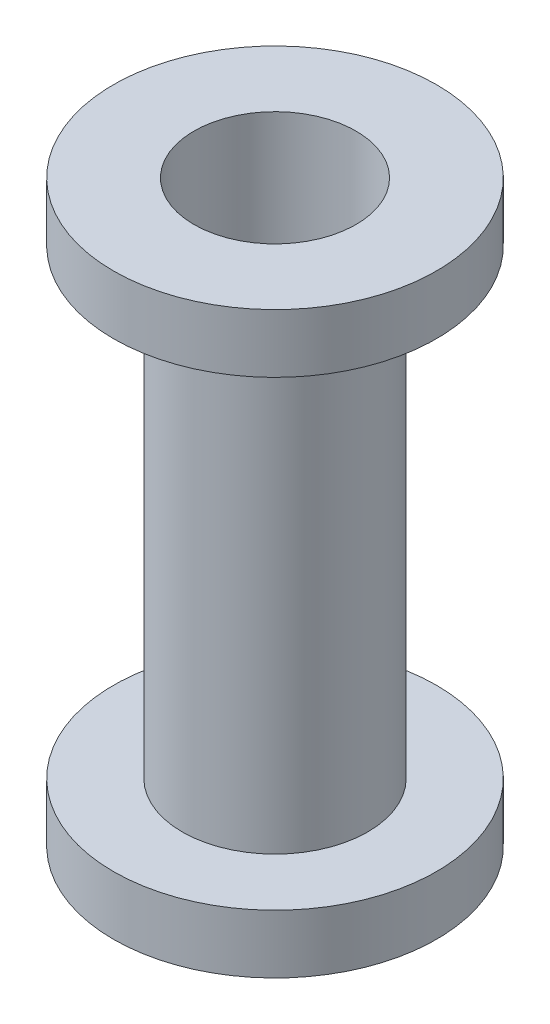
from build123d import *

# Parameters (mm, degrees)
SKETCH1_R      = 20.066
SKETCH1_R_2    = 17.526
EXTRUDE1_DEPTH = 125.222
EXTRUDE2_START = -12.7
SKETCH2_R      = 34.925
SKETCH2_R_2    = 17.526
EXTRUDE2_DEPTH = 12.7
SKETCH3_R      = 34.925
SKETCH3_R_2    = 17.526
EXTRUDE3_DEPTH = 12.7


with BuildPart() as part:
    # Sketch1 → Extrude1 (new body)
    with BuildSketch(Plane(origin=(0, 0, 0), x_dir=(1, 0, 0), z_dir=(0, 1, 0))):
        with Locations(Location((0, 0, 0), (0, 0, 270))):
            Circle(SKETCH1_R)
        with Locations(Location((0, 0, 0), (0, 0, 270))):
            Circle(SKETCH1_R_2, mode=Mode.SUBTRACT)
    extrude(amount=EXTRUDE1_DEPTH)

    # Sketch2 → Extrude2 (add)
    with BuildSketch(Plane(origin=(0, 125.222, 0), x_dir=(1, 0, 0), z_dir=(0, 1, 0)).offset(EXTRUDE2_START)):
        with Locations(Location((0, 0, 0), (0, 0, 270))):
            Circle(SKETCH2_R)
        with Locations(Location((0, 0, 0), (0, 0, 270))):
            Circle(SKETCH2_R_2, mode=Mode.SUBTRACT)
    extrude(amount=EXTRUDE2_DEPTH)

    # Sketch3 → Extrude3 (add)
    with BuildSketch(Plane.XZ):
        with Locations(Location((0, 0, 0), (0, 0, 90))):
            Circle(SKETCH3_R)
        with Locations(Location((0, 0, 0), (0, 0, 90))):
            Circle(SKETCH3_R_2, mode=Mode.SUBTRACT)
    extrude(amount=-EXTRUDE3_DEPTH)


solid = part.part
